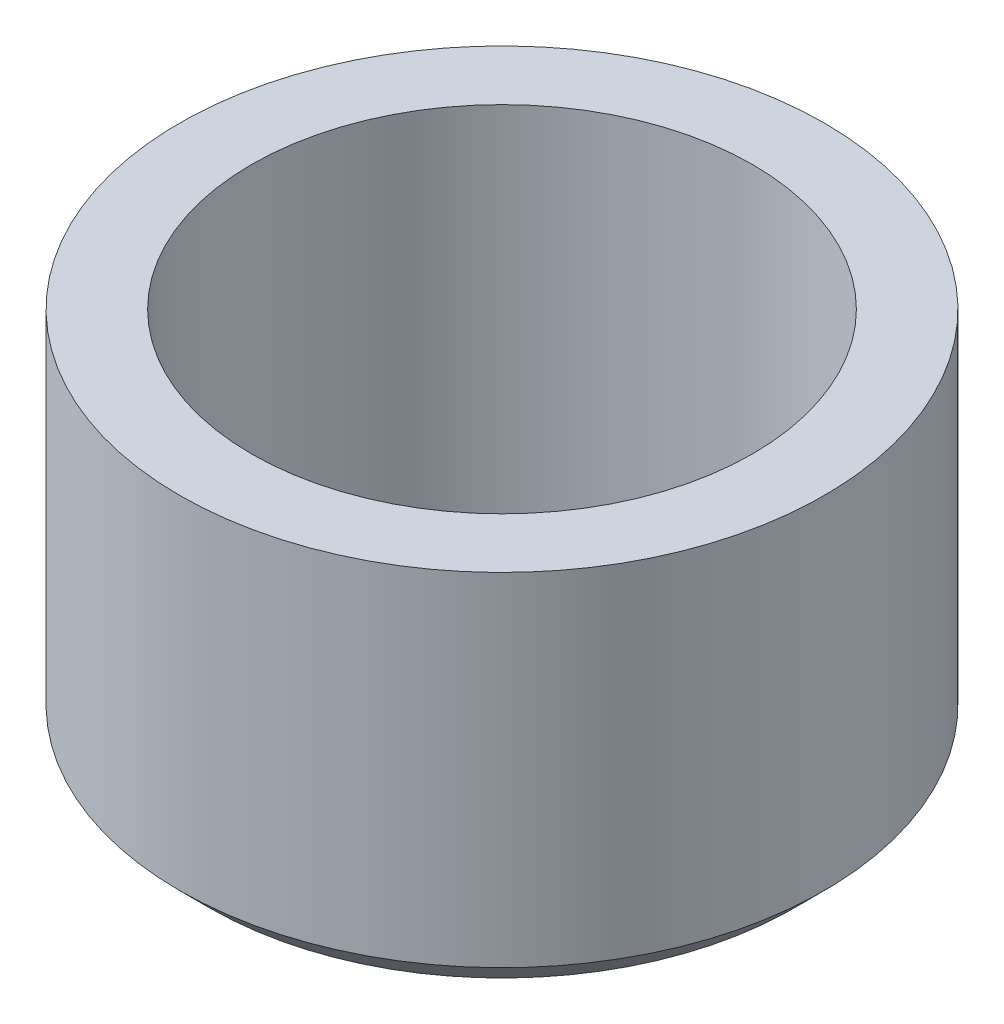
from build123d import *

# Parameters (mm, degrees)
SKETCH1_W     = 1.175
SKETCH1_H     = 6.1
CHAMFER1_SIZE = 0.5


with BuildPart() as part:
    # Sketch1 → Revolve1 (revolve)
    with BuildSketch(Plane.XY, mode=Mode.PRIVATE) as revolve1_sk:
        with Locations((-4.6875, 3.05)):
            Rectangle(SKETCH1_W, SKETCH1_H)
    revolve(revolve1_sk.sketch.rotate(Axis((0, 36.057377049, 0), (0, -1, 0)), 270), axis=Axis((0, 36.057377049, 0), (0, -1, 0)))

    # Chamfer1
    chamfer1_edges = [part.edges().sort_by_distance(p)[0] for p in [
        (0, 0, -5.275),
    ]]
    chamfer(chamfer1_edges, length=CHAMFER1_SIZE)


solid = part.part
